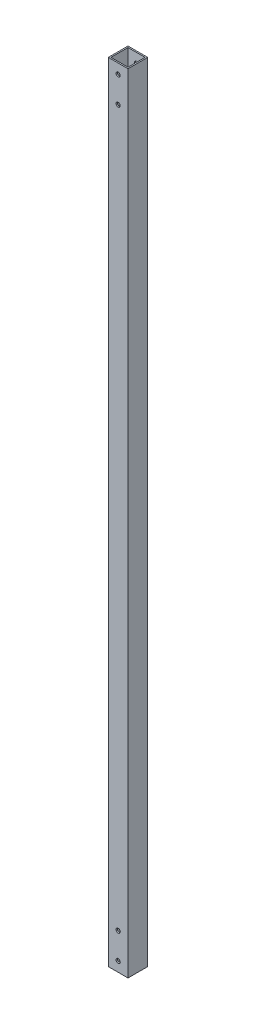
from build123d import *

# Parameters (mm, degrees)
SKETCH_1_W          = 15
SKETCH_1_H          = 15
SKETCH_1_W_2        = 13
SKETCH_1_H_2        = 13
EXTRUDE_1_DEPTH     = 600
SKETCH_2_R          = 1.6
CUT_EXTRUDE_1_DEPTH = 601.234329242


with BuildPart() as part:
    # 草图1 → 拉伸-薄壁1 (new body)
    with BuildSketch(Plane(origin=(0, 0, 0), x_dir=(1, 0, 0), z_dir=(0, 1, 0))):
        Rectangle(SKETCH_1_W, SKETCH_1_H)
        Rectangle(SKETCH_1_W_2, SKETCH_1_H_2, mode=Mode.SUBTRACT)
    extrude(amount=EXTRUDE_1_DEPTH)

    # 草图2 → 切除-拉伸1 (cut, through all)
    with BuildSketch(Plane.XY.offset(7.5)):
        with Locations((0, 7.5)):
            Circle(SKETCH_2_R)
        with Locations((0, 27.5)):
            Circle(SKETCH_2_R)
        with Locations((0, 592.5)):
            Circle(SKETCH_2_R)
        with Locations((0, 572.5)):
            Circle(SKETCH_2_R)
    extrude(amount=-CUT_EXTRUDE_1_DEPTH, mode=Mode.SUBTRACT)


solid = part.part
